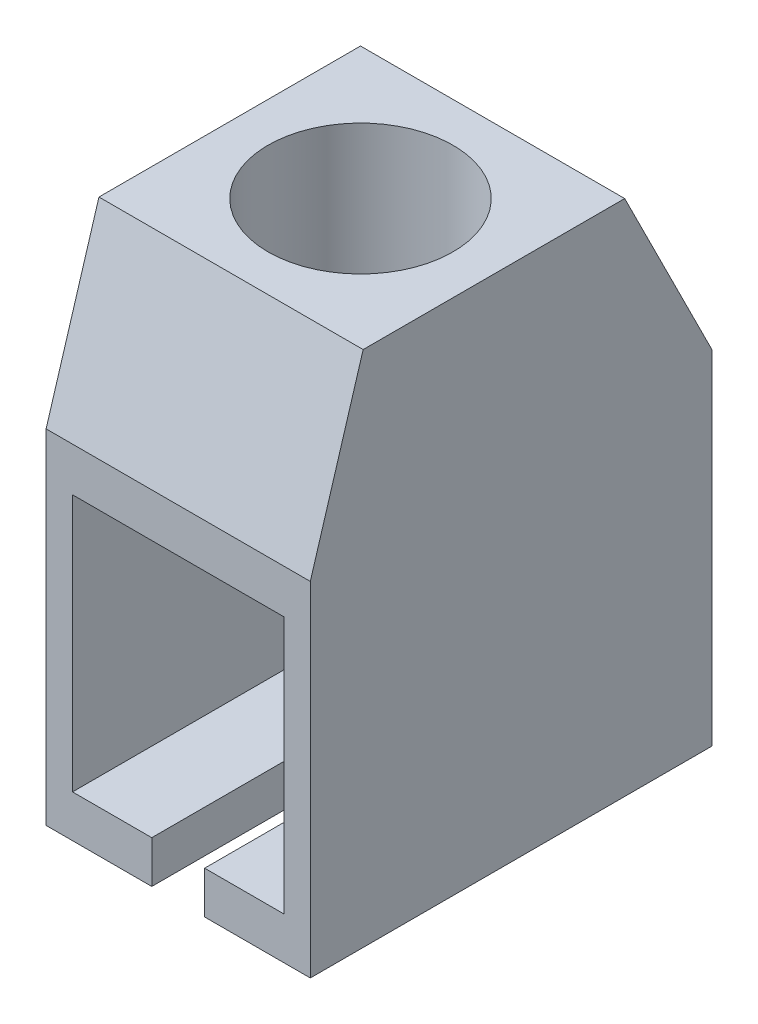
from build123d import *

# Parameters (mm, degrees)
SKETCH_1_W          = 5
SKETCH_1_H          = 7.6
EXTRUDE_1_DEPTH     = 6.5
SKETCH_2_W          = 1
SKETCH_2_H          = 3.75
CUT_EXTRUDE_1_DEPTH = 2
SKETCH_3_W          = 4
SKETCH_3_H          = 4.87
CUT_EXTRUDE_2_DEPTH = 6.8
SKETCH_4_W          = 5
SKETCH_4_H          = 7.6
EXTRUDE_2_DEPTH     = 3.3
CHAMFER_1_SIZE      = 3.3
CHAMFER_1_SIZE2     = 1
CHAMFER_2_SIZE      = 3.3
CHAMFER_2_SIZE2     = 1.65
SKETCH_5_R          = 0.4
CUT_EXTRUDE_3_DEPTH = 5
SKETCH_6_R          = 1.75
CUT_EXTRUDE_4_DEPTH = 4.13


with BuildPart() as part:
    # Эскиз1 → Бобышка-Вытянуть1 (new body)
    with BuildSketch(Plane(origin=(0, 0, 0), x_dir=(1, 0, 0), z_dir=(0, 1, 0))):
        Rectangle(SKETCH_1_W, SKETCH_1_H)
    extrude(amount=EXTRUDE_1_DEPTH)

    # Эскиз2 → Вырез-Вытянуть1 (cut)
    with BuildSketch(Plane.XZ):
        with Locations((0, 1.925)):
            Rectangle(SKETCH_2_W, SKETCH_2_H)
    extrude(amount=-CUT_EXTRUDE_1_DEPTH, mode=Mode.SUBTRACT)

    # Эскиз3 → Вырез-Вытянуть2 (cut)
    with BuildSketch(Plane.XY.offset(3.8)):
        with Locations((0, 3.235)):
            Rectangle(SKETCH_3_W, SKETCH_3_H)
    extrude(amount=-CUT_EXTRUDE_2_DEPTH, mode=Mode.SUBTRACT)

    # Эскиз4 → Бобышка-Вытянуть2 (add)
    with BuildSketch(Plane(origin=(0, 6.5, 0), x_dir=(1, 0, 0), z_dir=(0, 1, 0))):
        Rectangle(SKETCH_4_W, SKETCH_4_H)
    extrude(amount=EXTRUDE_2_DEPTH)

    # Фаска1
    chamfer_1_edges = [part.edges().sort_by_distance(p)[0] for p in [
        (0, 9.8, 3.8),
    ]]
    chamfer_1_side = [part.faces().sort_by_distance(p)[0] for p in [
        (0, 6.154672702, 3.8),
    ]]
    chamfer(chamfer_1_edges, length=CHAMFER_1_SIZE, length2=CHAMFER_1_SIZE2, reference=chamfer_1_side[0])

    # Фаска2
    chamfer_2_edges = [part.edges().sort_by_distance(p)[0] for p in [
        (0, 9.8, -3.8),
    ]]
    chamfer_2_side = [part.faces().sort_by_distance(p)[0] for p in [
        (0, 4.9, -3.8),
    ]]
    chamfer(chamfer_2_edges, length=CHAMFER_2_SIZE, length2=CHAMFER_2_SIZE2, reference=chamfer_2_side[0])

    # Эскиз5 → Вырез-Вытянуть3 (cut)
    with BuildSketch(Plane.XZ.offset(-5.67)):
        with Locations(Location((0, -2.6, 0), (0, 0, 270))):
            Circle(SKETCH_5_R)
    extrude(amount=-CUT_EXTRUDE_3_DEPTH, mode=Mode.SUBTRACT)

    # Эскиз6 → Вырез-Вытянуть4 (cut)
    with BuildSketch(Plane(origin=(0, 9.8, 0), x_dir=(1, 0, 0), z_dir=(0, 1, 0))):
        with Locations(Location((0, -0.35, 0), (0, 0, 270))):
            Circle(SKETCH_6_R)
    extrude(amount=-CUT_EXTRUDE_4_DEPTH, mode=Mode.SUBTRACT)


solid = part.part
